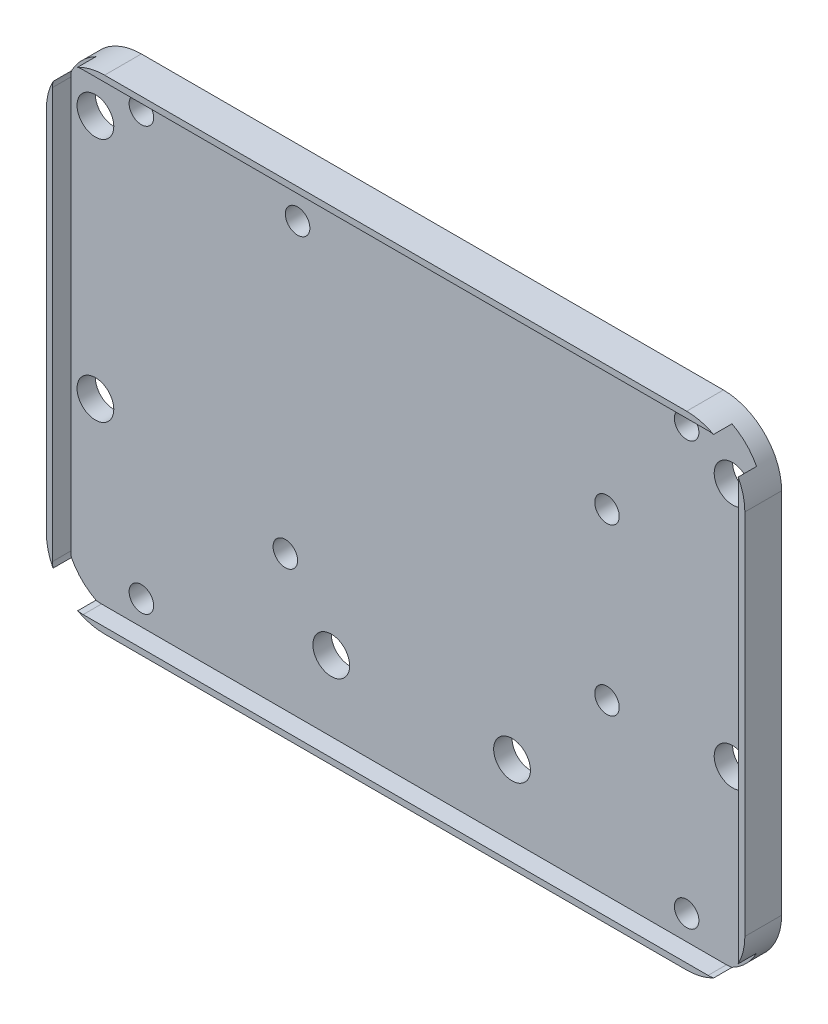
from build123d import *

# Parameters (mm, degrees)
ESQUISSE1_R             = 3
BOSS_EXTRU_3_DEPTH      = 6
ENL_V_MAT_EXTRU_2_DEPTH = 3
ESQUISSE5_R             = 2
ESQUISSE5_R_2           = 3
ENL_V_MAT_EXTRU_3_DEPTH = 3


with BuildPart() as part:
    # Esquisse1 → Boss.-Extru.3 (new body)
    with BuildSketch(Plane.XY):
        with BuildLine():
            Line((7.993323256, 75.345483427), (102.993323256, 75.345483427))
            ThreePointArc((102.993323256, 75.345483427), (109.710837677, 72.562997848), (112.493323256, 65.845483427))
            Line((112.493323256, 65.845483427), (112.493323256, 5.845483427))
            ThreePointArc((112.493323256, 5.845483427), (109.710837677, -0.872030995), (102.993323256, -3.654516573))
            Line((102.993323256, -3.654516573), (7.993323256, -3.654516573))
            ThreePointArc((7.993323256, -3.654516573), (1.275808835, -0.872030995), (-1.506676744, 5.845483427))
            Line((-1.506676744, 5.845483427), (-1.506676744, 65.845483427))
            ThreePointArc((-1.506676744, 65.845483427), (1.275808835, 72.562997848), (7.993323256, 75.345483427))
        make_face()
        with Locations((107.493323256, 65.845483427)):
            Circle(ESQUISSE1_R, mode=Mode.SUBTRACT)
        with Locations((107.493323256, 25.845483427)):
            Circle(ESQUISSE1_R, mode=Mode.SUBTRACT)
        with Locations((3.493323256, 65.845483427)):
            Circle(ESQUISSE1_R, mode=Mode.SUBTRACT)
        with Locations((3.493323256, 25.845483427)):
            Circle(ESQUISSE1_R, mode=Mode.SUBTRACT)
    extrude(amount=BOSS_EXTRU_3_DEPTH)

    # Esquisse3 → Enlèv. mat.-Extru.2 (cut)
    with BuildSketch(Plane.XY.offset(6)):
        with BuildLine():
            Line((4.493323256, 74.345483427), (106.493323256, 74.345483427))
            ThreePointArc((106.493323256, 74.345483427), (110.028857162, 72.881017333), (111.493323256, 69.345483427))
            Line((111.493323256, 69.345483427), (111.493323256, 2.345483427))
            ThreePointArc((111.493323256, 2.345483427), (110.028857162, -1.190050479), (106.493323256, -2.654516573))
            Line((106.493323256, -2.654516573), (4.493323256, -2.654516573))
            ThreePointArc((4.493323256, -2.654516573), (0.95778935, -1.190050479), (-0.506676744, 2.345483427))
            Line((-0.506676744, 2.345483427), (-0.506676744, 69.345483427))
            ThreePointArc((-0.506676744, 69.345483427), (0.95778935, 72.881017333), (4.493323256, 74.345483427))
        make_face()
    extrude(amount=-ENL_V_MAT_EXTRU_2_DEPTH, mode=Mode.SUBTRACT)

    # Esquisse5 → Enlèv. mat.-Extru.3 (cut)
    with BuildSketch(Plane.XY.offset(3)):
        with Locations((10.993323256, 70.345483427)):
            Circle(ESQUISSE5_R)
        with Locations((99.993323256, 70.345483427)):
            Circle(ESQUISSE5_R)
        with Locations((10.993323256, 1.345483427)):
            Circle(ESQUISSE5_R)
        with Locations((99.993323256, 1.345483427)):
            Circle(ESQUISSE5_R)
        with Locations((41.993323256, 8.845483427)):
            Circle(ESQUISSE5_R_2)
        with Locations((71.493323256, 8.845483427)):
            Circle(ESQUISSE5_R_2)
        with Locations((36.493323256, 67.473019046)):
            Circle(ESQUISSE5_R)
        with Locations((34.493323256, 19.473019046)):
            Circle(ESQUISSE5_R)
        with Locations((86.993323256, 51.973019046)):
            Circle(ESQUISSE5_R)
        with Locations((86.993323256, 24.973019046)):
            Circle(ESQUISSE5_R)
    extrude(amount=-ENL_V_MAT_EXTRU_3_DEPTH, mode=Mode.SUBTRACT)


solid = part.part
